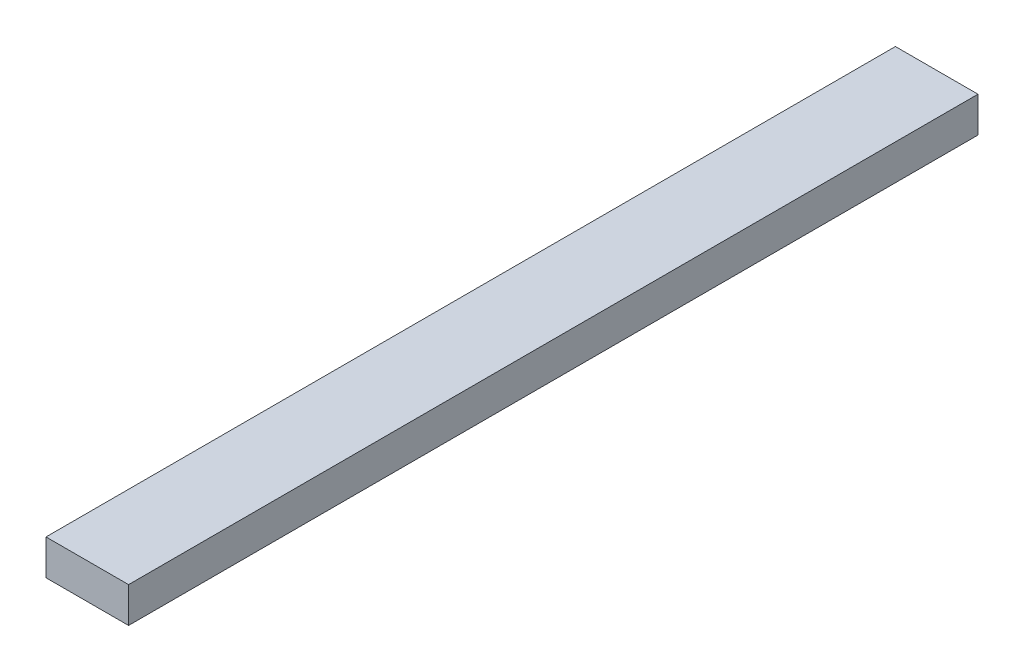
from build123d import *

# Parameters (mm, degrees)
SKETCH1_W           = 88.9
SKETCH1_H           = 38.1
BOSS_EXTRUDE1_DEPTH = 457.2


with BuildPart() as part:
    # Sketch1 → Boss-Extrude1 (new, symmetric)
    with BuildSketch(Plane.XY):
        Rectangle(SKETCH1_W, SKETCH1_H)
    extrude(amount=BOSS_EXTRUDE1_DEPTH, both=True)


solid = part.part
